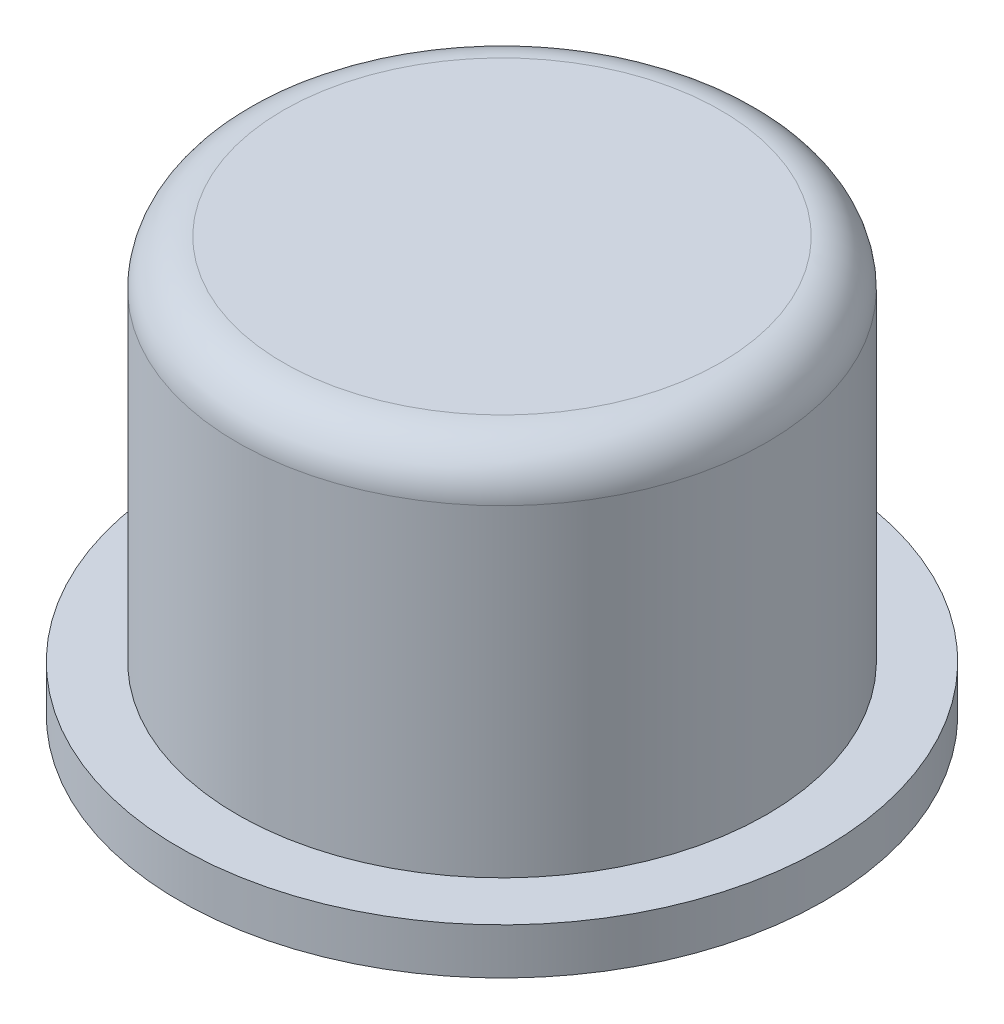
from build123d import *

# Parameters (mm, degrees)
SKETCH_5_R          = 1.85
CUT_EXTRUDE_1_DEPTH = 2.8


with BuildPart() as part:
    # 草图2 → 旋转1 (revolve)
    with BuildSketch(Plane.XY.offset(-3.85000283)):
        with BuildLine():
            Line((1.9, 3.6), (0, 3.6))
            Line((0, 3.6), (0, 0))
            Line((0, 0), (2.8, 0))
            Line((2.8, 0), (2.8, 0.4))
            Line((2.8, 0.4), (2.3, 0.4))
            Line((2.3, 0.4), (2.3, 3.2))
            ThreePointArc((2.3, 3.2), (2.182842712, 3.482842712), (1.9, 3.6))
        make_face()
    revolve(axis=Axis((0, 3.6, -3.85000283), (0, -1, 0)))

    # 草图5 → 切除-拉伸1 (cut)
    with BuildSketch(Plane.XZ):
        with Locations((0, -3.85000283)):
            Circle(SKETCH_5_R)
    extrude(amount=-CUT_EXTRUDE_1_DEPTH, mode=Mode.SUBTRACT)


solid = part.part
